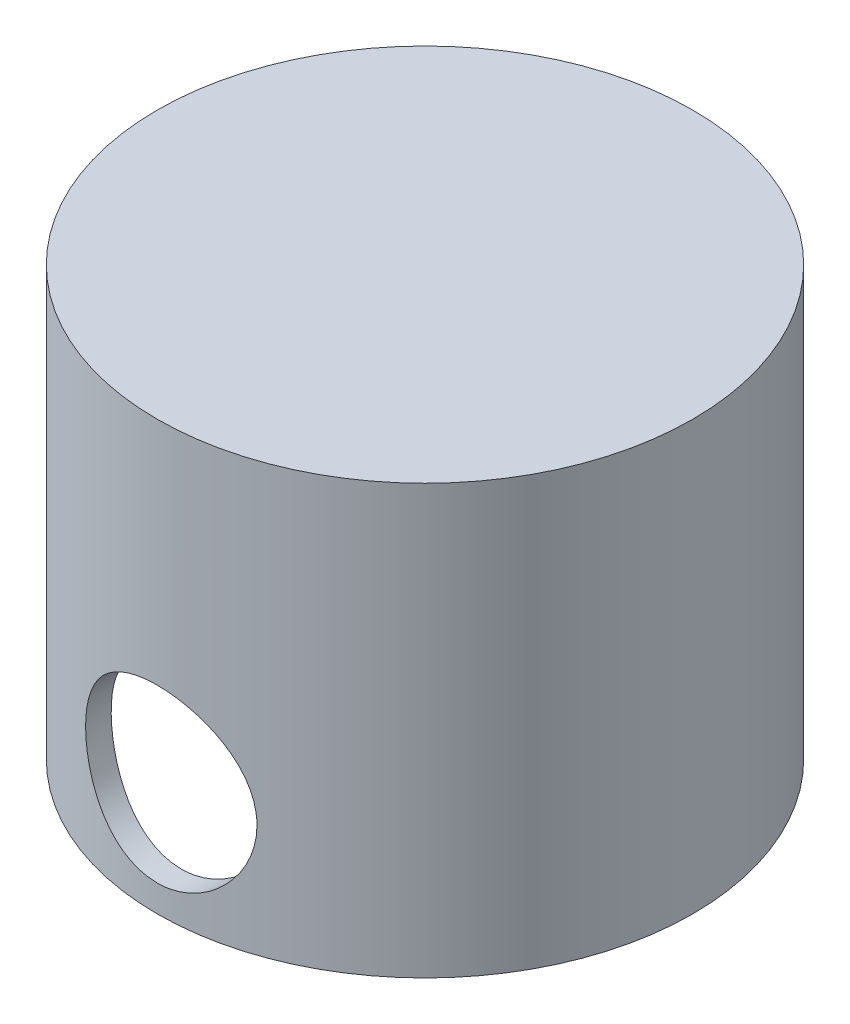
from build123d import *

# Parameters (mm, degrees)
SKETCH2_R               = 5
BOSS_EXTRUDE1_DEPTH     = 8
SKETCH4_R               = 4.55
CUT_EXTRUDE1_DEPTH      = 7.1
CUT_EXTRUDE2_DEPTH      = 11.677078252
CUT_EXTRUDE2_DEPTH_BACK = 11.677078252
SKETCH11_R              = 1.6


with BuildPart() as part:
    # Sketch2 → Boss-Extrude1 (new body)
    with BuildSketch(Plane(origin=(0, 0, 0), x_dir=(1, 0, 0), z_dir=(0, 1, 0))):
        with Locations(Location((0, 0, 0), (0, 0, 270))):
            Circle(SKETCH2_R)
    extrude(amount=BOSS_EXTRUDE1_DEPTH)

    # Sketch4 → Cut-Extrude1 (cut)
    with BuildSketch(Plane(origin=(0, 0, 0), x_dir=(1, 0, 0), z_dir=(0, 1, 0))):
        with Locations(Location((0, 0, 0), (0, 0, 270))):
            Circle(SKETCH4_R)
    extrude(amount=CUT_EXTRUDE1_DEPTH, mode=Mode.SUBTRACT)

    # Sketch11 → Cut-Extrude2 (cut, two sides: drawn at the far end of the back side and taken through both)
    with BuildSketch(Plane.XY.offset(-CUT_EXTRUDE2_DEPTH_BACK)):
        with Locations((0, 2.1)):
            Circle(SKETCH11_R)
    extrude(amount=CUT_EXTRUDE2_DEPTH + CUT_EXTRUDE2_DEPTH_BACK, mode=Mode.SUBTRACT)


solid = part.part
